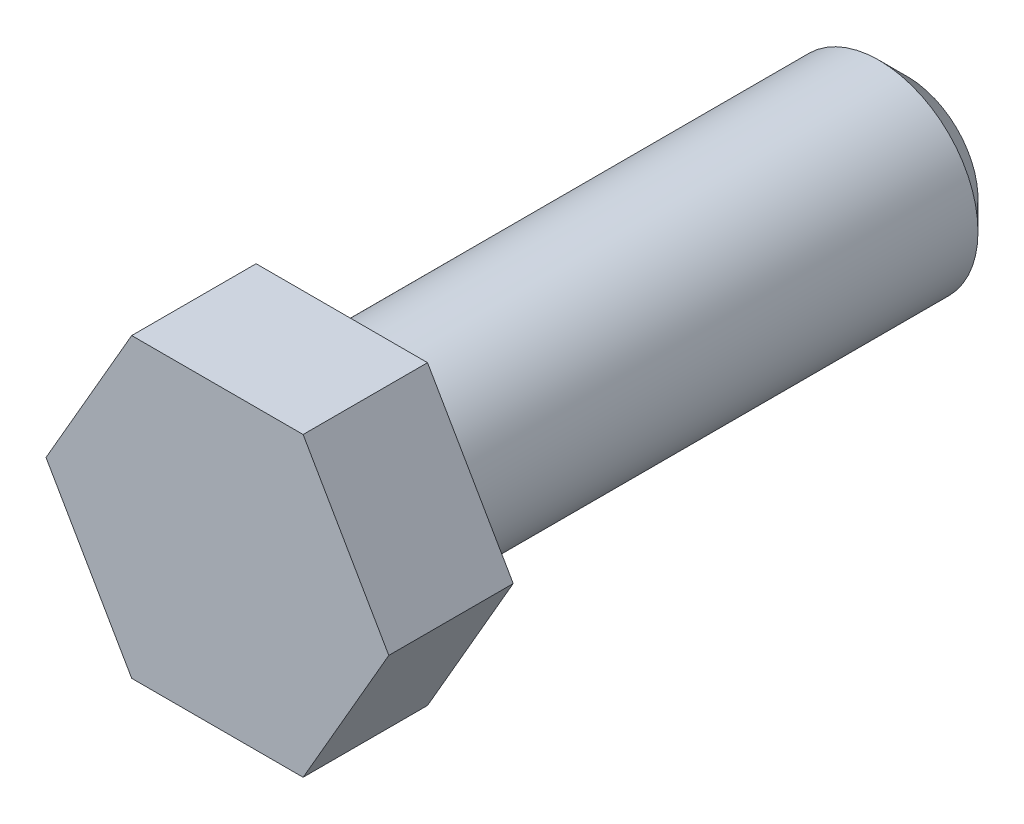
from build123d import *

# Parameters (mm, degrees)
BASE_EXTRUDE_DEPTH  = 8.8
SKETCH3_R           = 7
BOSS_EXTRUDE1_DEPTH = 40
CHAMFER1_SIZE       = 2


with BuildPart() as part:
    # Sketch1 → Base-Extrude (new body)
    with BuildSketch(Plane.XY):
        Polygon((-6.062177826, 10.5), (6.062177826, 10.5), (12.124355653, 0), (6.062177826, -10.5), (-6.062177826, -10.5), (-12.124355653, 0), align=None)
    extrude(amount=BASE_EXTRUDE_DEPTH)

    # Sketch3 → Boss-Extrude1 (add)
    with BuildSketch(Plane(origin=(0, 0, 0), x_dir=(-1, 0, 0), z_dir=(0, 0, -1))):
        with Locations(Location((0, 0, 0), (0, 0, 180))):
            Circle(SKETCH3_R)
    extrude(amount=BOSS_EXTRUDE1_DEPTH)

    # Chamfer1
    chamfer1_edges = [part.edges().sort_by_distance(p)[0] for p in [
        (-7, 0, -40),
    ]]
    chamfer(chamfer1_edges, length=CHAMFER1_SIZE)


solid = part.part
